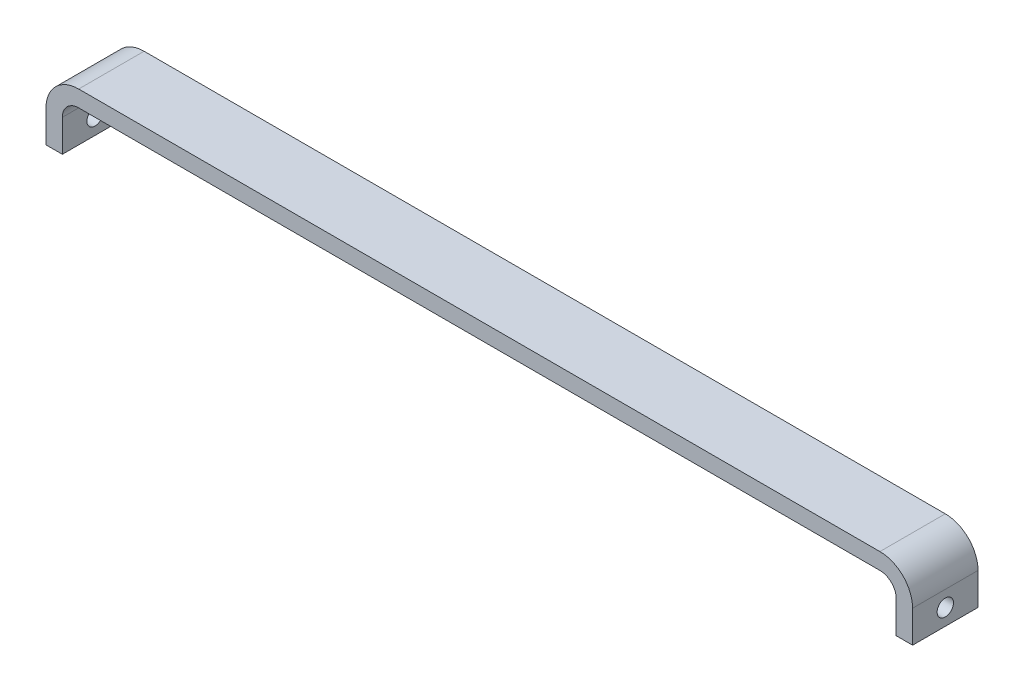
from build123d import *

# Parameters (mm, degrees)
BOSS_EXTRUDE2_DEPTH = 40
SKETCH3_R           = 5
CUT_EXTRUDE1_DEPTH  = 533.980449923


with BuildPart() as part:
    # Sketch1 → Boss-Extrude2 (new body)
    with BuildSketch(Plane.XY):
        with BuildLine():
            Line((20, 29.6), (510, 29.6))
            ThreePointArc((510, 29.6), (517.071067812, 26.671067812), (520, 19.6))
            Line((520, 19.6), (520, 0))
            Line((520, 0), (530, 0))
            Line((530, 0), (530, 19.6))
            ThreePointArc((530, 19.6), (524.142135624, 33.742135624), (510, 39.6))
            Line((510, 39.6), (20, 39.6))
            ThreePointArc((20, 39.6), (5.857864376, 33.742135624), (0, 19.6))
            Line((0, 19.6), (0, 0))
            Line((0, 0), (10, 0))
            Line((10, 0), (10, 19.6))
            ThreePointArc((10, 19.6), (12.928932188, 26.671067812), (20, 29.6))
        make_face()
    extrude(amount=BOSS_EXTRUDE2_DEPTH)

    # Sketch3 → Cut-Extrude1 (cut, through all)
    with BuildSketch(Plane.ZY):
        with Locations((20, 10)):
            Circle(SKETCH3_R)
    extrude(amount=-CUT_EXTRUDE1_DEPTH, mode=Mode.SUBTRACT)


solid = part.part
